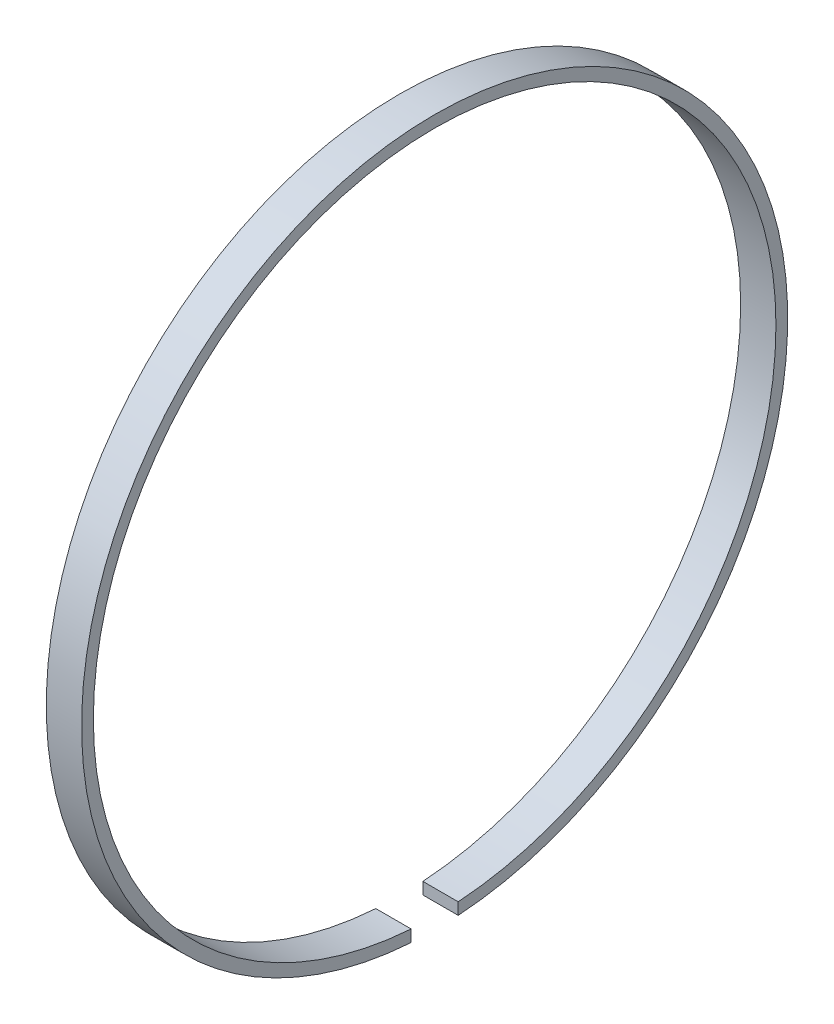
from build123d import *

# Parameters (mm, degrees)
BOSS_EXTRUDE1_DEPTH = 1.5


with BuildPart() as part:
    # Sketch2 → Boss-Extrude1 (new body)
    with BuildSketch(Plane(origin=(0, 0, 0), x_dir=(0, 0, -1), z_dir=(1, 0, 0))):
        with BuildLine():
            Line((-1, -14.465476141), (-1, -14.966629547))
            ThreePointArc((-1, -14.966629547), (0, 15), (1, -14.966629547))
            Line((1, -14.966629547), (1, -14.465476141))
            ThreePointArc((1, -14.465476141), (0, 14.5), (-1, -14.465476141))
        make_face()
    extrude(amount=BOSS_EXTRUDE1_DEPTH)


solid = part.part
